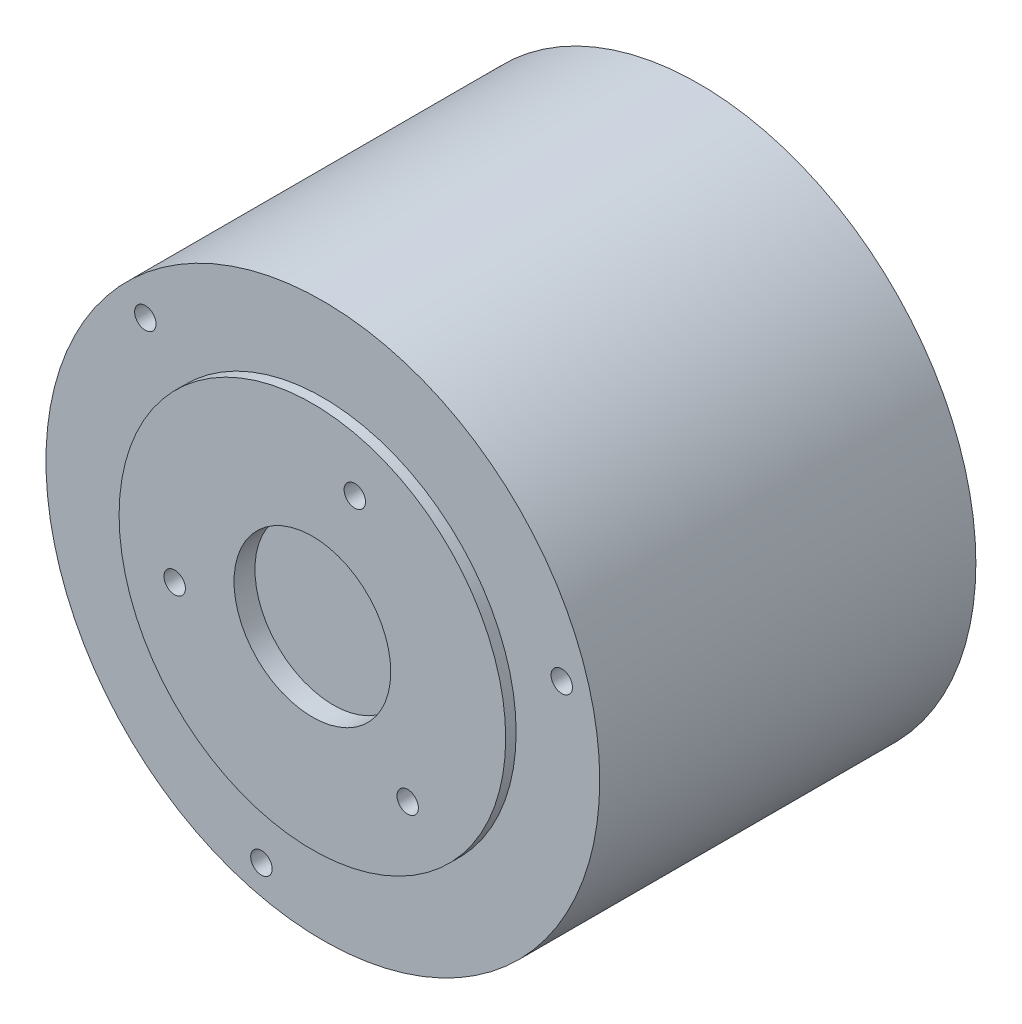
from build123d import *

# Parameters (mm, degrees)
SKETCH3_R           = 26.5
BOSS_EXTRUDE1_DEPTH = 37
SKETCH4_OUTSIDE_W   = 71.718
SKETCH4_OUTSIDE_H   = 71.718
SKETCH4_OUTSIDE_R   = 18.5
CUT_EXTRUDE1_DEPTH  = 1
SKETCH5_R           = 7.5
CUT_EXTRUDE2_DEPTH  = 2
CUT_EXTRUDE3_START  = -24.5
SKETCH6_W           = 30
SKETCH6_H           = 10
CUT_EXTRUDE3_DEPTH  = 29.16402947
CIRPATTERN1_COUNT   = 3
CIRPATTERN2_COUNT   = 3
CIRPATTERN3_COUNT   = 6


with BuildPart() as part:
    # Sketch3 → Boss-Extrude1 (new body)
    with BuildSketch(Plane.XY):
        Circle(SKETCH3_R)
    extrude(amount=-BOSS_EXTRUDE1_DEPTH)

    # Sketch4 outside → Cut-Extrude1 (cut)
    with BuildSketch(Plane.XY):
        Rectangle(SKETCH4_OUTSIDE_W, SKETCH4_OUTSIDE_H)
        Circle(SKETCH4_OUTSIDE_R, mode=Mode.SUBTRACT)
    extrude(amount=-CUT_EXTRUDE1_DEPTH, mode=Mode.SUBTRACT)

    # Sketch5 → Cut-Extrude2 (cut)
    with BuildSketch(Plane.XY):
        Circle(SKETCH5_R)
    extrude(amount=-CUT_EXTRUDE2_DEPTH, mode=Mode.SUBTRACT)

    # Sketch6 → Cut-Extrude3 (cut, through all)
    with BuildSketch(Plane.XY.offset(CUT_EXTRUDE3_START)):
        with Locations((0, -28)):
            Rectangle(SKETCH6_W, SKETCH6_H)
    extrude(amount=-CUT_EXTRUDE3_DEPTH, mode=Mode.SUBTRACT)

    # Sketch8 → M2.5x0.45 Tapped Hole1 (revolve, cut)
    with BuildSketch(Plane(origin=(-5.878275914, -23.011048917, -1), x_dir=(0, -1, 0), z_dir=(1, 0, 0))):
        Polygon((0, 0), (0, 6.965882135), (1.025, 6.35), (1.025, 0), align=None)
    m2_5x0_45_tapped_hole1 = revolve(axis=Axis((-5.878275914, -23.011048917, 5.35), (0, 0, -1)), mode=Mode.SUBTRACT)

    # Sketch10 → M2.5x0.45 Tapped Hole2 (revolve, cut)
    with BuildSketch(Plane(origin=(4.059528293, 12.875178835, 0), x_dir=(0, -1, 0), z_dir=(1, 0, 0))):
        Polygon((0, 0), (0, 4.965882135), (1.025, 4.35), (1.025, 0), align=None)
    m2_5x0_45_tapped_hole2 = revolve(axis=Axis((4.059528293, 12.875178835, 6.35), (0, 0, -1)), mode=Mode.SUBTRACT)

    # Sketch12 → M2.5x0.45 Tapped Hole3 (revolve, cut)
    with BuildSketch(Plane(origin=(0, 22.5, -37), x_dir=(0, 1, 0), z_dir=(1, 0, 0))):
        Polygon((0, 0), (0, 6.965882135), (1.025, 6.35), (1.025, 0), align=None)
    m2_5x0_45_tapped_hole3 = revolve(axis=Axis((0, 22.5, -43.35), (0, 0, 1)), mode=Mode.SUBTRACT)

    # CirPattern1: M2.5x0.45 Tapped Hole1 ×3 about axis
    cirpattern1_axis = Axis((0, 0, 50.701413821), (0, 0, -1))
    for i in range(1, CIRPATTERN1_COUNT):
        add(m2_5x0_45_tapped_hole1.rotate(cirpattern1_axis, i * 360 / CIRPATTERN1_COUNT), mode=Mode.SUBTRACT)

    # CirPattern2: M2.5x0.45 Tapped Hole2 ×3 about axis
    cirpattern2_axis = Axis((0, 0, 50.701413821), (0, 0, -1))
    for i in range(1, CIRPATTERN2_COUNT):
        add(m2_5x0_45_tapped_hole2.rotate(cirpattern2_axis, i * 360 / CIRPATTERN2_COUNT), mode=Mode.SUBTRACT)

    # CirPattern3: M2.5x0.45 Tapped Hole3 ×6 about axis, 1 skipped
    cirpattern3_axis = Axis((0, 0, 50.701413821), (0, 0, -1))
    add([m2_5x0_45_tapped_hole3.rotate(cirpattern3_axis, i * 360 / CIRPATTERN3_COUNT) for i in range(1, CIRPATTERN3_COUNT) if i not in (3,)], mode=Mode.SUBTRACT)


solid = part.part
